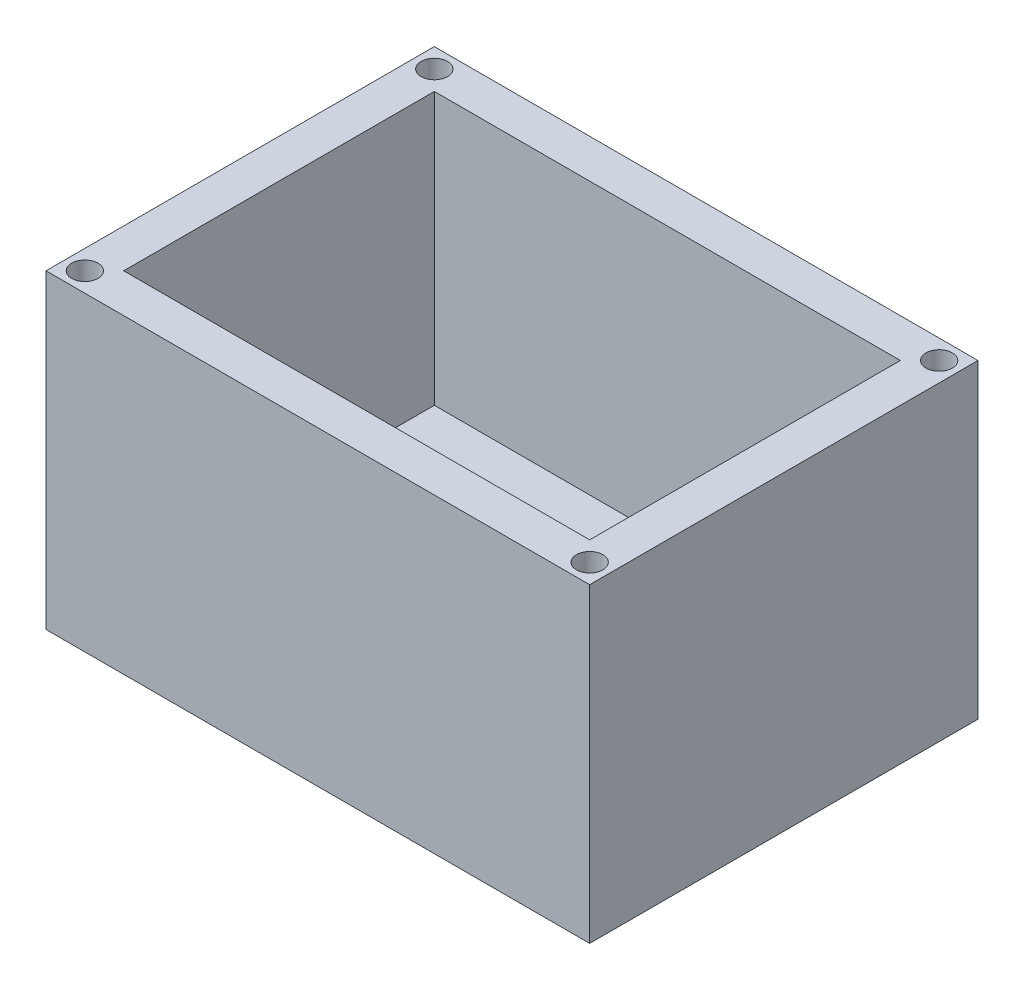
from build123d import *

# Parameters (mm, degrees)
CROQUIS1_W                       = 70
CROQUIS1_H                       = 50
SALIENTE_EXTRUIR1_DEPTH          = 40
CROQUIS2_W                       = 60
CROQUIS2_H                       = 40
CORTAR_EXTRUIR1_DEPTH            = 71.017609314
CROQUIS3_W                       = 60
CROQUIS3_H                       = 40
SALIENTE_EXTRUIR2_DEPTH          = 5
TALADRO_DE_MARGEN_PARA_M31_D     = 3.4
TALADRO_DE_MARGEN_PARA_M31_DEPTH = 20
TALADRO_DE_MARGEN_PARA_M31_TIP   = 1.021463052


with BuildPart() as part:
    # Croquis1 → Saliente-Extruir1 (new body)
    with BuildSketch(Plane(origin=(0, 0, 0), x_dir=(1, 0, 0), z_dir=(0, 1, 0))):
        with Locations((10.018270402, -10.71863581)):
            Rectangle(CROQUIS1_W, CROQUIS1_H)
    extrude(amount=SALIENTE_EXTRUIR1_DEPTH)

    # Croquis2 → Cortar-Extruir1 (cut, through all)
    with BuildSketch(Plane(origin=(0, 0, 0), x_dir=(1, 0, 0), z_dir=(0, 1, 0))):
        with Locations((10.018270402, -10.71863581)):
            Rectangle(CROQUIS2_W, CROQUIS2_H)
    extrude(amount=CORTAR_EXTRUIR1_DEPTH, mode=Mode.SUBTRACT)

    # Croquis3 → Saliente-Extruir2 (add)
    with BuildSketch(Plane(origin=(0, 0, 0), x_dir=(1, 0, 0), z_dir=(0, 1, 0))):
        with Locations((10.018270402, -10.71863581)):
            Rectangle(CROQUIS3_W, CROQUIS3_H)
    extrude(amount=SALIENTE_EXTRUIR2_DEPTH)

    # Taladro de margen para M31
    with Locations(Plane(origin=(-22.481719301, 40, -11.781363893), x_dir=(0, 0, 1), z_dir=(0, 1, 0))):
        with Locations((0, 0), (-2.33e-07, 64.999991125), (44.999999703, 64.999989703), (45.0000013, 65.000000057), (45.000001979, 1.038e-06)):
            Hole(TALADRO_DE_MARGEN_PARA_M31_D / 2, depth=TALADRO_DE_MARGEN_PARA_M31_DEPTH)
            with Locations((0, 0, -(TALADRO_DE_MARGEN_PARA_M31_DEPTH + TALADRO_DE_MARGEN_PARA_M31_TIP / 2))):  # 118° drill point
                Cone(0, TALADRO_DE_MARGEN_PARA_M31_D / 2, TALADRO_DE_MARGEN_PARA_M31_TIP, mode=Mode.SUBTRACT)


solid = part.part
